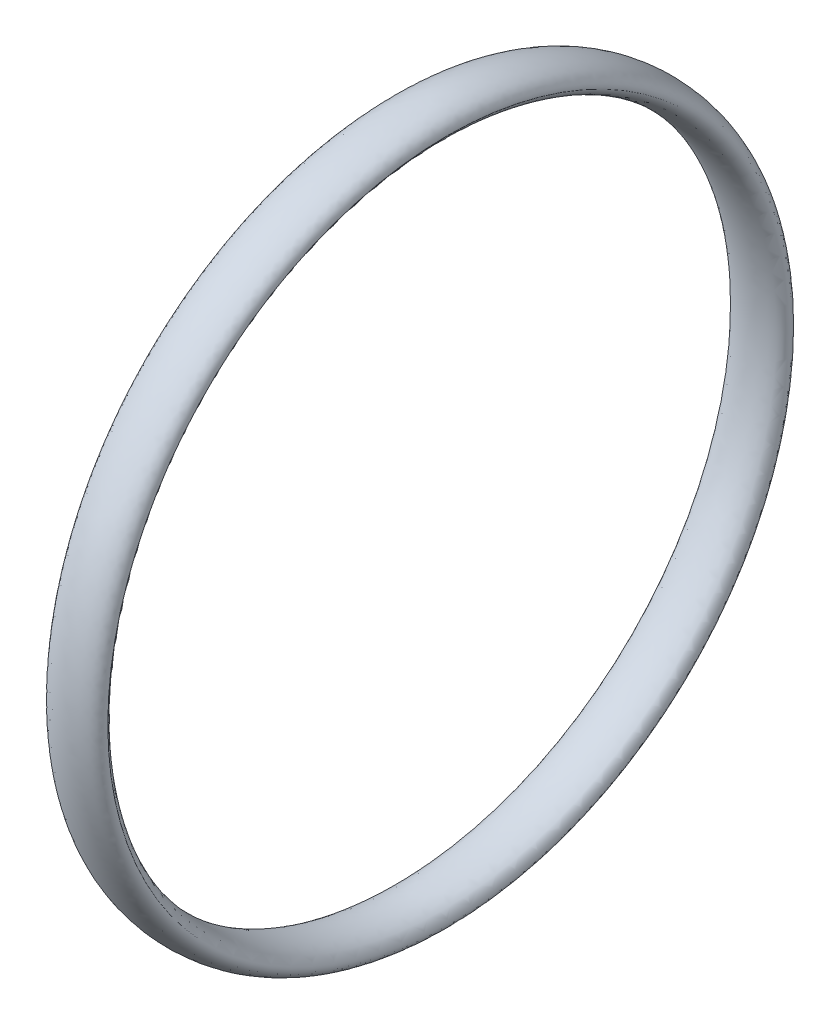
from build123d import *

# Parameters (mm, degrees)
SKETCH1_RX = 1.36525
SKETCH1_RY = 0.6858


with BuildPart() as part:
    # Sketch1 → Revolve1 (revolve)
    with BuildSketch(Plane(origin=(0, 0, 0), x_dir=(1, 0, 0), z_dir=(0, 1, 0))):
        with Locations((0, 16.5608)):
            Ellipse(SKETCH1_RX, SKETCH1_RY)
    revolve(axis=Axis((-1000, 0, 0), (1, 0, 0)))


solid = part.part
